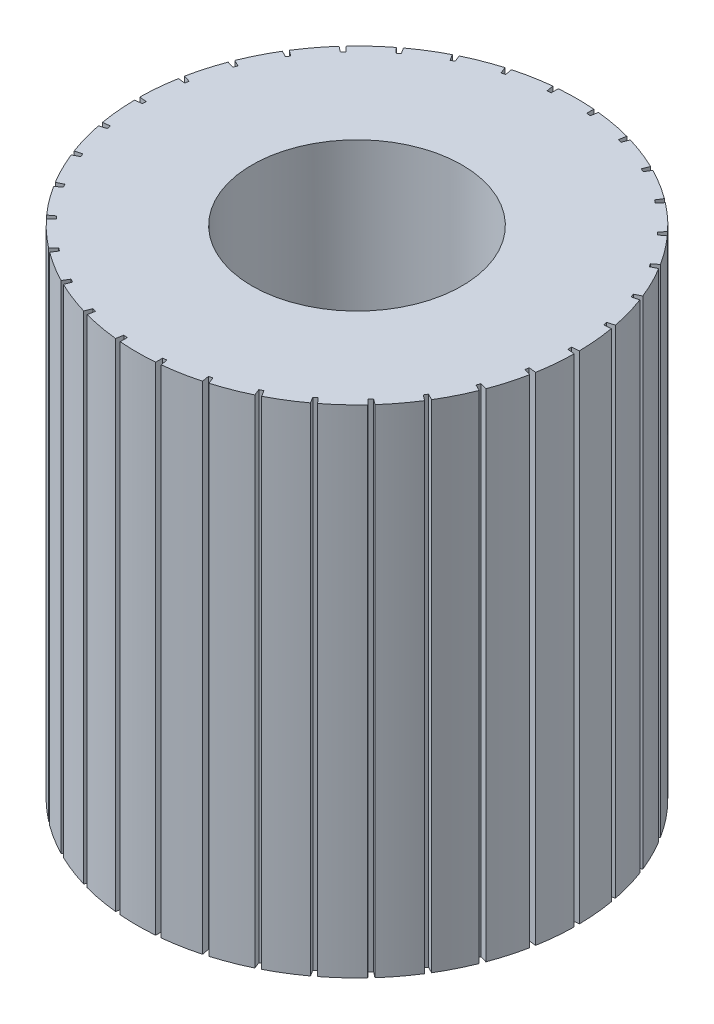
from build123d import *

# Parameters (mm, degrees)
SKETCH1_R                = 15
BOSS_EXTRUDE1_DEPTH      = 35
SKETCH2_R                = 7.4
CUT_EXTRUDE1_DEPTH       = 16.6
BOSS_EXTRUDE4_REACH      = 46.179
BOSS_EXTRUDE4_END_RADIUS = 17
SKETCH5_W                = 2.5
SKETCH5_H                = 35
CIRPATTERN1_COUNT        = 34
CUT_EXTRUDE2_DEPTH       = 43.460544331
CUT_EXTRUDE2_DEPTH_BACK  = 43.460544331
SKETCH6_R                = 17
SKETCH6_R_2              = 15.5


with BuildPart() as part:
    # Sketch1 → Boss-Extrude1 (new body)
    with BuildSketch(Plane(origin=(0, 0, 0), x_dir=(1, 0, 0), z_dir=(0, 1, 0))):
        with Locations(Location((0, 0, 0), (0, 0, 270))):
            Circle(SKETCH1_R)
    extrude(amount=BOSS_EXTRUDE1_DEPTH)

    # Sketch2 → Cut-Extrude1 (cut)
    with BuildSketch(Plane(origin=(0, 35, 0), x_dir=(1, 0, 0), z_dir=(0, 1, 0))):
        with Locations(Location((0, 0, 0), (0, 0, 270))):
            Circle(SKETCH2_R)
    extrude(amount=-CUT_EXTRUDE1_DEPTH, mode=Mode.SUBTRACT)

    # Boss-Extrude4: up to this cylinder (the profile starts inside it)
    boss_extrude4_end = Plane(origin=(0, 17.5, 0), z_dir=(0, -1, 0)) * Cylinder(BOSS_EXTRUDE4_END_RADIUS, 127.358, mode=Mode.PRIVATE)
    # Sketch5 → Boss-Extrude4 (add, up to the surface)
    with BuildSketch(Plane.XY.offset(7.4), mode=Mode.PRIVATE) as boss_extrude4_sk1:
        with Locations((0, 17.5)):
            Rectangle(SKETCH5_W, SKETCH5_H)
    boss_extrude4_tool1 = extrude(boss_extrude4_sk1.sketch, amount=BOSS_EXTRUDE4_REACH, mode=Mode.PRIVATE) & boss_extrude4_end
    boss_extrude4 = boss_extrude4_tool1.solids().sort_by_distance((0, 17.5, 7.4))[0]
    add(boss_extrude4)

    # CirPattern1: Boss-Extrude4 ×34 about axis
    cirpattern1_axis = Axis((0, 0, 0), (0, 1, 0))
    for i in range(1, CIRPATTERN1_COUNT):
        add(boss_extrude4.rotate(cirpattern1_axis, i * 360 / CIRPATTERN1_COUNT))

    # Sketch6 → Cut-Extrude2 (cut, two sides: drawn at the far end of the back side and taken through both)
    with BuildSketch(Plane(origin=(0, 35, 0), x_dir=(1, 0, 0), z_dir=(0, 1, 0)).offset(-CUT_EXTRUDE2_DEPTH_BACK)):
        Circle(SKETCH6_R)
        Circle(SKETCH6_R_2, mode=Mode.SUBTRACT)
    extrude(amount=CUT_EXTRUDE2_DEPTH + CUT_EXTRUDE2_DEPTH_BACK, mode=Mode.SUBTRACT)


solid = part.part
